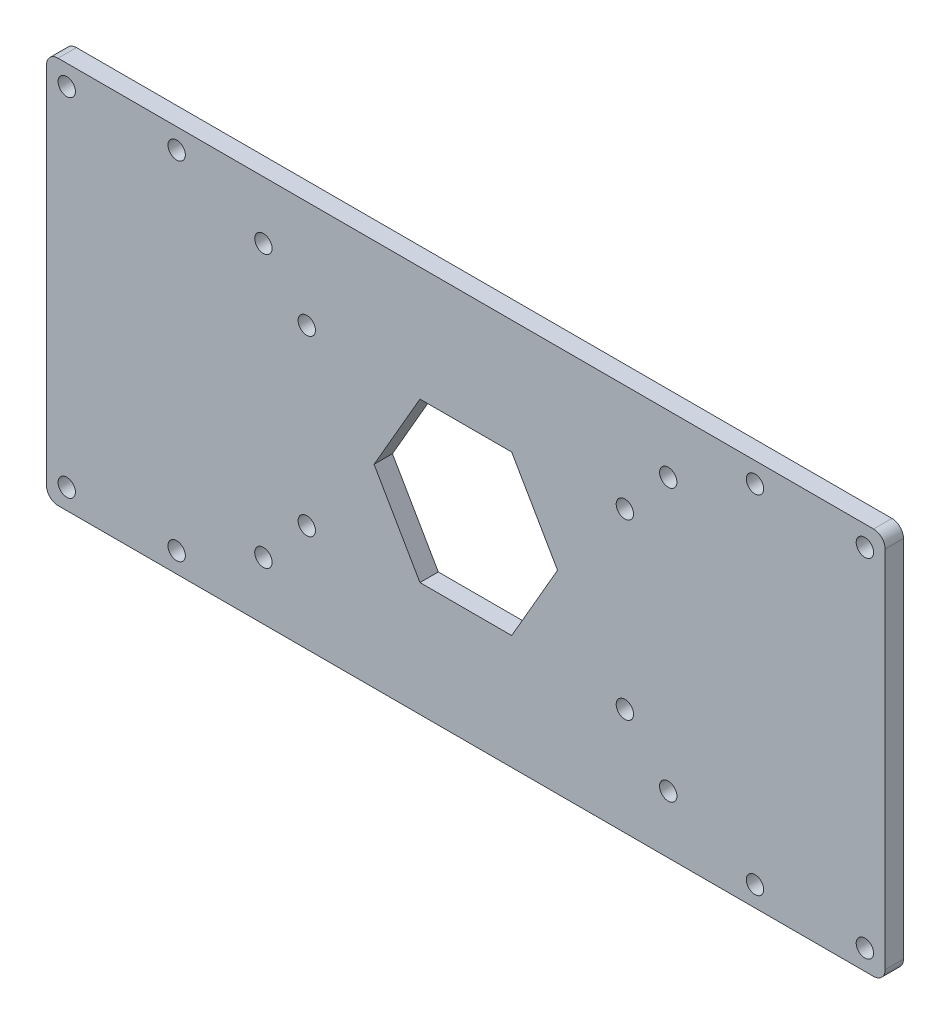
from build123d import *

# Parameters (mm, degrees)
SKETCH1_W           = 145
SKETCH1_H           = 67
SKETCH1_R           = 1.5
BOSS_EXTRUDE1_DEPTH = 3.175
FILLET2_R           = 2


with BuildPart() as part:
    # Sketch1 → Boss-Extrude1 (new body)
    with BuildSketch(Plane.XY):
        Rectangle(SKETCH1_W, SKETCH1_H)
        with Locations((-35, 23.5)):
            Circle(SKETCH1_R, mode=Mode.SUBTRACT)
        with Locations((35, 23.5)):
            Circle(SKETCH1_R, mode=Mode.SUBTRACT)
        with Locations((35, -23.5)):
            Circle(SKETCH1_R, mode=Mode.SUBTRACT)
        with Locations((-35, -23.5)):
            Circle(SKETCH1_R, mode=Mode.SUBTRACT)
        with Locations((-27.5, 15)):
            Circle(SKETCH1_R, mode=Mode.SUBTRACT)
        with Locations((27.5, 15)):
            Circle(SKETCH1_R, mode=Mode.SUBTRACT)
        with Locations((27.5, -15)):
            Circle(SKETCH1_R, mode=Mode.SUBTRACT)
        with Locations((-27.5, -15)):
            Circle(SKETCH1_R, mode=Mode.SUBTRACT)
        with Locations((-69, 30)):
            Circle(SKETCH1_R, mode=Mode.SUBTRACT)
        with Locations((-50, 30)):
            Circle(SKETCH1_R, mode=Mode.SUBTRACT)
        with Locations((-50, -30)):
            Circle(SKETCH1_R, mode=Mode.SUBTRACT)
        with Locations((-69, -30)):
            Circle(SKETCH1_R, mode=Mode.SUBTRACT)
        with Locations((50, -30)):
            Circle(SKETCH1_R, mode=Mode.SUBTRACT)
        with Locations((69, -30)):
            Circle(SKETCH1_R, mode=Mode.SUBTRACT)
        with Locations((50, 30)):
            Circle(SKETCH1_R, mode=Mode.SUBTRACT)
        with Locations((69, 30)):
            Circle(SKETCH1_R, mode=Mode.SUBTRACT)
        Polygon((15.862719753, 0), (7.931359877, 13.737518279), (-7.931359877, 13.737518279), (-15.862719753, 0), (-7.931359877, -13.737518279), (7.931359877, -13.737518279), align=None, mode=Mode.SUBTRACT)
    extrude(amount=BOSS_EXTRUDE1_DEPTH)

    # Fillet2
    fillet2_edges = [part.edges().sort_by_distance(p)[0] for p in [
        (-72.5, 33.5, 1.5875),
        (72.5, 33.5, 1.5875),
        (72.5, -33.5, 1.5875),
        (-72.5, -33.5, 1.5875),
    ]]
    fillet(fillet2_edges, radius=FILLET2_R)


solid = part.part
